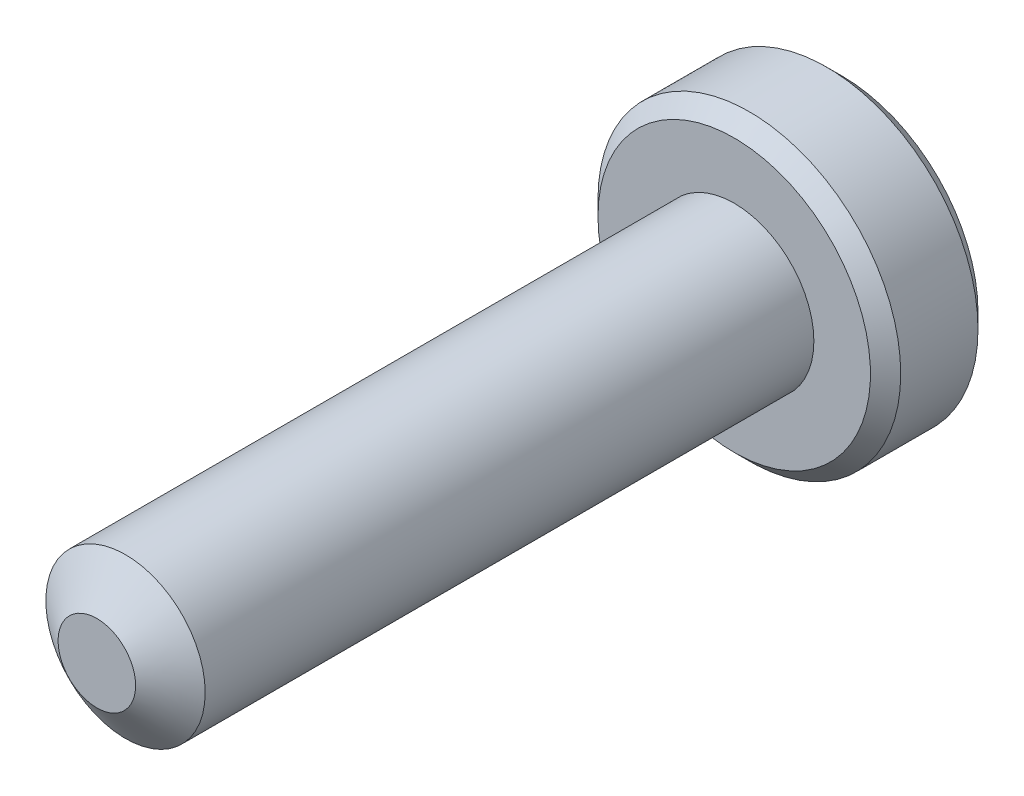
from build123d import *

# Parameters (mm, degrees)
SKETCH1_R          = 1
EXTRUDE1_DEPTH     = 8
SKETCH6_R          = 1.9
EXTRUDE2_DEPTH     = 1.35
CUT_EXTRUDE1_DEPTH = 0.975
CHAMFER1_SIZE      = 0.19


with BuildPart() as part:
    # Sketch1 → Extrude1 (new body)
    with BuildSketch(Plane.XY):
        Circle(SKETCH1_R)
    extrude(amount=-EXTRUDE1_DEPTH)

    # Sketch4 → Cut-Revolve1 (revolve, cut)
    with BuildSketch(Plane(origin=(0, 0, 0), x_dir=(0, 0, -1), z_dir=(1, 0, 0))):
        Polygon((0.35977197, 1), (0, 0.486192379), (0, 1), align=None)
    revolve(axis=Axis((0, 0, 0), (0, 0, -1)), mode=Mode.SUBTRACT)

    # Sketch6 → Extrude2 (add)
    with BuildSketch(Plane(origin=(0, 0, -8), x_dir=(-1, 0, 0), z_dir=(0, 0, -1))):
        Circle(SKETCH6_R)
    extrude(amount=EXTRUDE2_DEPTH)

    # Sketch7 → Cut-Extrude1 (cut)
    with BuildSketch(Plane(origin=(0, 0, -9.35), x_dir=(-1, 0, 0), z_dir=(0, 0, -1))):
        Polygon((0, 0.75055535), (-0.65, 0.375277675), (-0.65, -0.375277675), (0, -0.75055535), (0.65, -0.375277675), (0.65, 0.375277675), align=None)
    extrude(amount=-CUT_EXTRUDE1_DEPTH, mode=Mode.SUBTRACT)

    # Cut-Extrude2 cone 1 section (through the dimple's axis) → Cut-Extrude2 (revolve, cut)
    with BuildSketch(Plane(origin=(0, 0, -9.35), x_dir=(0, 1, 0), z_dir=(1, 0, 0))):
        Polygon((0, 0), (0.75055535, 0), (0, 0.75055535), align=None)
    revolve(axis=Axis((0, 0, -9.35), (0, 0, 1)), mode=Mode.SUBTRACT)

    # Chamfer1
    chamfer1_edges = [part.edges().sort_by_distance(p)[0] for p in [
        (1.9, 0, -9.35),
        (1.9, 0, -8),
    ]]
    chamfer(chamfer1_edges, length=CHAMFER1_SIZE)


solid = part.part
